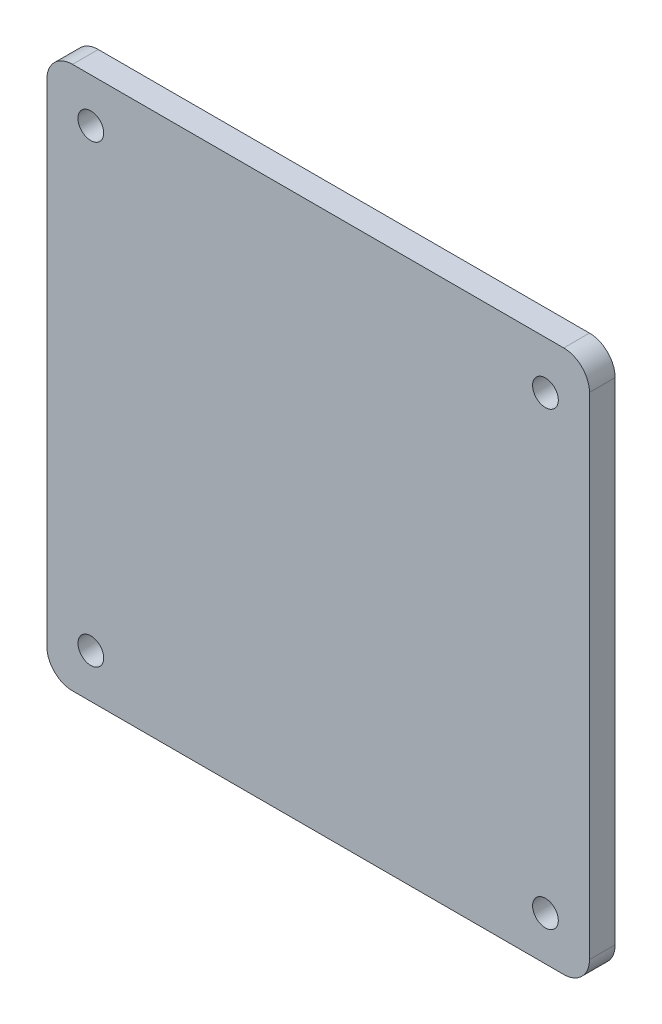
from build123d import *

# Parameters (mm, degrees)
BOSS_EXTRUDE1_DEPTH = 2.54
SKETCH2_R           = 1.27
CUT_EXTRUDE1_DEPTH  = 38.98170636


with BuildPart() as part:
    # Sketch1 → Boss-Extrude1 (new body)
    with BuildSketch(Plane.XY):
        with BuildLine():
            Line((24.257, 26.797), (-24.257, 26.797))
            ThreePointArc((-24.257, 26.797), (-26.053051224, 26.053051224), (-26.797, 24.257))
            Line((-26.797, 24.257), (-26.797, -24.257))
            ThreePointArc((-26.797, -24.257), (-26.053051224, -26.053051224), (-24.257, -26.797))
            Line((-24.257, -26.797), (24.257, -26.797))
            ThreePointArc((24.257, -26.797), (26.053051224, -26.053051224), (26.797, -24.257))
            Line((26.797, -24.257), (26.797, 24.257))
            ThreePointArc((26.797, 24.257), (26.053051224, 26.053051224), (24.257, 26.797))
        make_face()
    extrude(amount=BOSS_EXTRUDE1_DEPTH)

    # Sketch2 → Cut-Extrude1 (cut, through all)
    with BuildSketch(Plane(origin=(0, 0, 0), x_dir=(-1, 0, 0), z_dir=(0, 0, -1))):
        with Locations((22.450640303, -22.450640303)):
            Circle(SKETCH2_R)
        with Locations((-22.450640303, -22.450640303)):
            Circle(SKETCH2_R)
        with Locations((-22.450640303, 22.060679213)):
            Circle(SKETCH2_R)
        with Locations((22.450640303, 22.450640303)):
            Circle(SKETCH2_R)
    extrude(amount=-CUT_EXTRUDE1_DEPTH, mode=Mode.SUBTRACT)


solid = part.part
